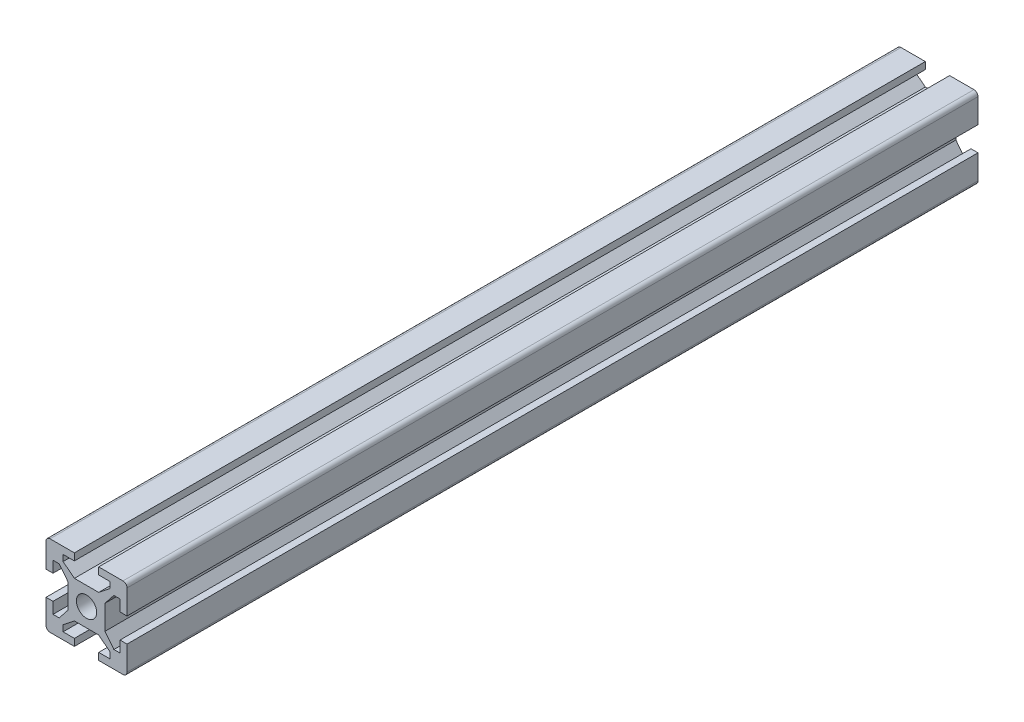
from build123d import *

# Parameters (mm, degrees)
BOSS_EXTRUDE1_DEPTH     = 105
CUT_EXTRUDE1_DEPTH      = 211.475651798
CUT_EXTRUDE1_DEPTH_BACK = 211.475651798
SKETCH2_R               = 2.5
FILLET1_R               = 1


with BuildPart() as part:
    # Sketch1 → Boss-Extrude1 (new, symmetric)
    with BuildSketch(Plane.XY):
        Polygon((-10, 10), (-3, 10), (-3, 8.272610059), (-5.783778863, 8.272610059), (-5.783778863, 6.747994248), (-3, 4.550753814), (3, 4.550753814), (5.783778863, 6.747994248), (5.783778863, 8.272610059), (3, 8.272610059), (3, 10), (10, 10), (10, 3), (8.272610059, 3), (8.272610059, 5.783778863), (6.747994248, 5.783778863), (4.55, 3.000595152), (4.55, -2.999404848), (6.747994248, -5.783778863), (8.272610059, -5.783778863), (8.272610059, -3), (10, -3), (10, -10), (3, -10), (3, -8.272610059), (5.783778863, -8.272610059), (5.783778863, -6.747994248), (2.999404848, -4.55), (-3.000595152, -4.55), (-5.783778863, -6.747994248), (-5.783778863, -8.272610059), (-3, -8.272610059), (-3, -10), (-10, -10), (-10, -3), (-8.272610059, -3), (-8.272610059, -5.783778863), (-6.747994248, -5.783778863), (-4.55, -3.000595152), (-4.55, 2.999404848), (-6.747994248, 5.783778863), (-8.272610059, 5.783778863), (-8.272610059, 3), (-10, 3), align=None)
    extrude(amount=BOSS_EXTRUDE1_DEPTH, both=True)

    # Sketch2 → Cut-Extrude1 (cut, two sides: drawn at the far end of the back side and taken through both)
    with BuildSketch(Plane.XY.offset(105).offset(-CUT_EXTRUDE1_DEPTH_BACK)):
        Circle(SKETCH2_R)
    extrude(amount=CUT_EXTRUDE1_DEPTH + CUT_EXTRUDE1_DEPTH_BACK, mode=Mode.SUBTRACT)

    # Fillet1
    fillet1_edges = [part.edges().sort_by_distance(p)[0] for p in [
        (-10, 10, 0),
        (10, 10, 0),
        (10, -10, 0),
        (-10, -10, 0),
    ]]
    fillet(fillet1_edges, radius=FILLET1_R)


solid = part.part
